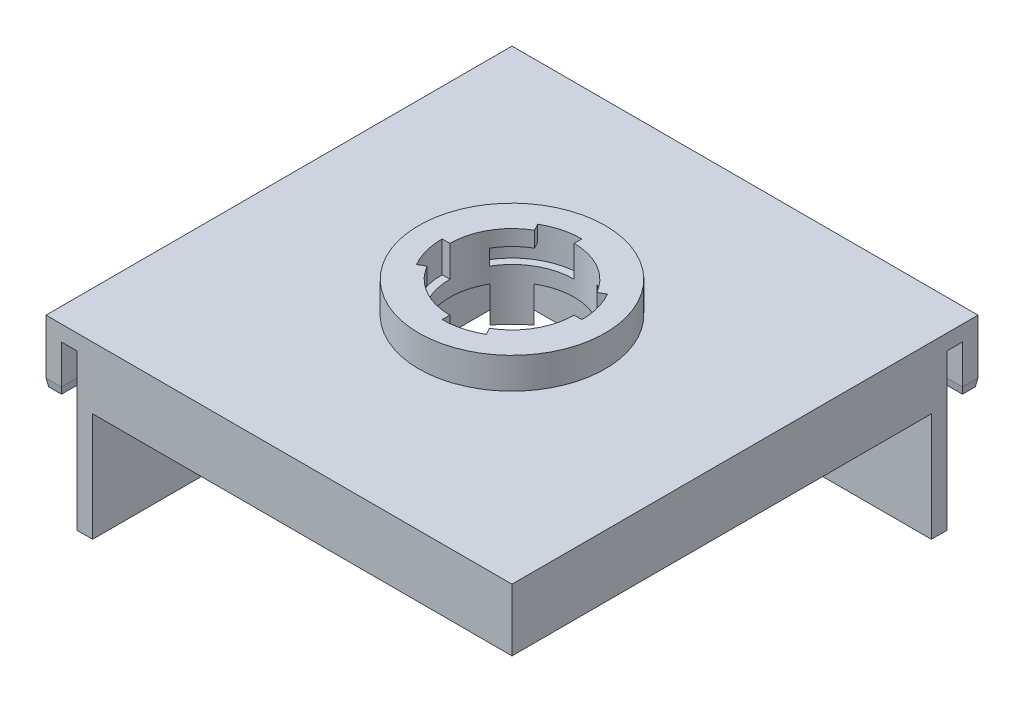
from build123d import *
from OCP.BRepFilletAPI import BRepFilletAPI_MakeChamfer
from build123d.topology import SkipClean

# Parameters (mm, degrees)
SKETCH1_R                 = 12
SKETCH1_R_2               = 8
BOSS_EXTRUDE4_DEPTH       = 2
BOSS_EXTRUDE5_START       = 2
SKETCH1_9_R               = 12
SKETCH1_9_R_2             = 9
BOSS_EXTRUDE5_DEPTH       = 4
BOSS_EXTRUDE6_START       = 2
BOSS_EXTRUDE6_DEPTH       = 2
BOSS_EXTRUDE7_START       = 4
BOSS_EXTRUDE7_DEPTH       = 2
SKETCH1_12_W              = 60
SKETCH1_12_H              = 60
SKETCH1_12_R              = 12
SKETCH1_12_R_2            = 9
SKETCH1_12_R_3            = 8
BOSS_EXTRUDE8_DEPTH       = 2
BOSS_EXTRUDE9_DEPTH       = 6
CHAMFER1_SIZE             = 1
CHAMFER1_SIZE2            = 0.176326981
BOSS_EXTRUDE10_DEPTH      = 6
BOSS_EXTRUDE11_DEPTH      = 20
BOSS_EXTRUDE12_DEPTH      = 2
BOSS_EXTRUDE12_DEPTH_BACK = 2
SKETCH1_14_R              = 8
CUT_EXTRUDE1_DEPTH        = 47.904157598


with BuildPart() as part:
    # Sketch1 → Boss-Extrude4 (new body)
    with BuildSketch(Plane(origin=(0, 0, 0), x_dir=(1, 0, 0), z_dir=(0, 1, 0))):
        with Locations(Location((0, 0, 0), (0, 0, 270))):
            Circle(SKETCH1_R)
        with Locations(Location((0, 0, 0), (0, 0, 270))):
            Circle(SKETCH1_R_2, mode=Mode.SUBTRACT)
    extrude(amount=BOSS_EXTRUDE4_DEPTH)

    # Sketch1<9> → Boss-Extrude5 (add)
    with BuildSketch(Plane(origin=(0, 0, 0), x_dir=(1, 0, 0), z_dir=(0, 1, 0)).offset(BOSS_EXTRUDE5_START)):
        with Locations(Location((0, 0, 0), (0, 0, 270))):
            Circle(SKETCH1_9_R)
        with Locations(Location((0, 0, 0), (0, 0, 270))):
            Circle(SKETCH1_9_R_2, mode=Mode.SUBTRACT)
    extrude(amount=BOSS_EXTRUDE5_DEPTH)

    # Sketch1<10> → Boss-Extrude6 (add)
    with SkipClean():  # the faces are left unmerged after this step: merging them gives an invalid solid
        with BuildSketch(Plane(origin=(0, 0, 0), x_dir=(1, 0, 0), z_dir=(0, 1, 0)).offset(BOSS_EXTRUDE6_START)):
            with BuildLine():
                ThreePointArc((0, 8), (2.070552361, 7.72740661), (4, 6.92820323))
                Line((4, 6.92820323), (4.5, 7.794228634))
                ThreePointArc((4.5, 7.794228634), (2.329371406, 8.693332437), (0, 9))
                Line((0, 9), (0, 8))
            make_face()
            with BuildLine():
                ThreePointArc((-8, 0), (-7.72740661, 2.070552361), (-6.92820323, 4))
                Line((-6.92820323, 4), (-7.794228634, 4.5))
                ThreePointArc((-7.794228634, 4.5), (-8.693332437, 2.329371406), (-9, 0))
                Line((-9, 0), (-8, 0))
            make_face()
            with BuildLine():
                Line((0, -9), (0, -8))
                ThreePointArc((0, -8), (-2.070552361, -7.72740661), (-4, -6.92820323))
                Line((-4, -6.92820323), (-4.5, -7.794228634))
                ThreePointArc((-4.5, -7.794228634), (-2.329371406, -8.693332437), (0, -9))
            make_face()
            with BuildLine():
                Line((9, 0), (8, 0))
                ThreePointArc((8, 0), (7.72740661, -2.070552361), (6.92820323, -4))
                Line((6.92820323, -4), (7.794228634, -4.5))
                ThreePointArc((7.794228634, -4.5), (8.693332437, -2.329371406), (9, 0))
            make_face()
        extrude(amount=BOSS_EXTRUDE6_DEPTH)

    # Sketch1<11> → Boss-Extrude7 (add)
    with SkipClean():  # the faces are left unmerged after this step: merging them gives an invalid solid
        with BuildSketch(Plane(origin=(0, 0, 0), x_dir=(1, 0, 0), z_dir=(0, 1, 0)).offset(BOSS_EXTRUDE7_START)):
            with BuildLine():
                ThreePointArc((0, 8), (2.070552361, 7.72740661), (4, 6.92820323))
                Line((4, 6.92820323), (4.5, 7.794228634))
                ThreePointArc((4.5, 7.794228634), (2.329371406, 8.693332437), (0, 9))
                Line((0, 9), (0, 8))
            make_face()
            with BuildLine():
                ThreePointArc((4, 6.92820323), (5.656854249, 5.656854249), (6.92820323, 4))
                Line((6.92820323, 4), (7.794228634, 4.5))
                ThreePointArc((7.794228634, 4.5), (6.363961031, 6.363961031), (4.5, 7.794228634))
                Line((4.5, 7.794228634), (4, 6.92820323))
            make_face()
            with BuildLine():
                ThreePointArc((-8, 0), (-7.72740661, 2.070552361), (-6.92820323, 4))
                Line((-6.92820323, 4), (-7.794228634, 4.5))
                ThreePointArc((-7.794228634, 4.5), (-8.693332437, 2.329371406), (-9, 0))
                Line((-9, 0), (-8, 0))
            make_face()
            with BuildLine():
                ThreePointArc((-6.92820323, 4), (-5.656854249, 5.656854249), (-4, 6.92820323))
                Line((-4, 6.92820323), (-4.5, 7.794228634))
                ThreePointArc((-4.5, 7.794228634), (-6.363961031, 6.363961031), (-7.794228634, 4.5))
                Line((-7.794228634, 4.5), (-6.92820323, 4))
            make_face()
            with BuildLine():
                Line((-4.5, -7.794228634), (-4, -6.92820323))
                ThreePointArc((-4, -6.92820323), (-5.656854249, -5.656854249), (-6.92820323, -4))
                Line((-6.92820323, -4), (-7.794228634, -4.5))
                ThreePointArc((-7.794228634, -4.5), (-6.363961031, -6.363961031), (-4.5, -7.794228634))
            make_face()
            with BuildLine():
                Line((0, -9), (0, -8))
                ThreePointArc((0, -8), (-2.070552361, -7.72740661), (-4, -6.92820323))
                Line((-4, -6.92820323), (-4.5, -7.794228634))
                ThreePointArc((-4.5, -7.794228634), (-2.329371406, -8.693332437), (0, -9))
            make_face()
            with BuildLine():
                Line((9, 0), (8, 0))
                ThreePointArc((8, 0), (7.72740661, -2.070552361), (6.92820323, -4))
                Line((6.92820323, -4), (7.794228634, -4.5))
                ThreePointArc((7.794228634, -4.5), (8.693332437, -2.329371406), (9, 0))
            make_face()
            with BuildLine():
                Line((7.794228634, -4.5), (6.92820323, -4))
                ThreePointArc((6.92820323, -4), (5.656854249, -5.656854249), (4, -6.92820323))
                Line((4, -6.92820323), (4.5, -7.794228634))
                ThreePointArc((4.5, -7.794228634), (6.363961031, -6.363961031), (7.794228634, -4.5))
            make_face()
        extrude(amount=BOSS_EXTRUDE7_DEPTH)

    # Sketch1<12> → Boss-Extrude8 (add)
    # profile 1 of 2: a face of its own
    with BuildSketch(Plane(origin=(0, 0, 0), x_dir=(1, 0, 0), z_dir=(0, 1, 0))):
        Rectangle(SKETCH1_12_W, SKETCH1_12_H)
        with Locations(Location((0, 0, 0), (0, 0, 270))):
            Circle(SKETCH1_12_R, mode=Mode.SUBTRACT)
    # profile 2 of 2: a face of its own
    with BuildSketch(Plane(origin=(0, 0, 0), x_dir=(1, 0, 0), z_dir=(0, 1, 0))):
        Circle(SKETCH1_12_R_2)
        with Locations(Location((0, 0, 0), (0, 0, 270))):
            Circle(SKETCH1_12_R_3, mode=Mode.SUBTRACT)
    extrude(amount=BOSS_EXTRUDE8_DEPTH)

    # Sketch3 → Boss-Extrude9 (add)
    with BuildSketch(Plane.XZ):
        Polygon((-30, -30), (30, -30), (30, -28), (-28, -28), (-28, 30), (-30, 30), align=None)
        Polygon((30, -26), (30, -24), (-24, -24), (-24, 30), (-26, 30), (-26, -26), align=None)
    extrude(amount=BOSS_EXTRUDE9_DEPTH)

    # Chamfer1: one chamfer whose edges measure the first distance from different faces: ONE call of the kernel's chamfer builder (chamfer() names one face for all edges)
    chamfer1_edges_1 = [part.edges().sort_by_distance(p)[0] for p in [
        (-28, -6, 1),
    ]]
    chamfer1_side_1 = [part.faces().sort_by_distance(p)[0] for p in [
        (-28, -3, 1),
    ]]
    chamfer1_edges_2 = [part.edges().sort_by_distance(p)[0] for p in [
        (1, -6, -28),
    ]]
    chamfer1_side_2 = [part.faces().sort_by_distance(p)[0] for p in [
        (1, -3, -28),
    ]]
    chamfer1_edges_3 = [part.edges().sort_by_distance(p)[0] for p in [
        (-29, -6, 30),
    ]]
    chamfer1_side_3 = [part.faces().sort_by_distance(p)[0] for p in [
        (-4.5, 0.333333333, 30),
    ]]
    chamfer1_edges_4 = [part.edges().sort_by_distance(p)[0] for p in [
        (-30, -6, 0),
    ]]
    chamfer1_side_4 = [part.faces().sort_by_distance(p)[0] for p in [
        (-30, -2, 0),
    ]]
    chamfer1_edges_5 = [part.edges().sort_by_distance(p)[0] for p in [
        (0, -6, -30),
    ]]
    chamfer1_side_5 = [part.faces().sort_by_distance(p)[0] for p in [
        (0, -2, -30),
    ]]
    chamfer1_edges_6 = [part.edges().sort_by_distance(p)[0] for p in [
        (30, -6, -29),
    ]]
    chamfer1_side_6 = [part.faces().sort_by_distance(p)[0] for p in [
        (30, 0.333333333, -4.5),
    ]]
    chamfer1 = BRepFilletAPI_MakeChamfer(part.part.solid().wrapped)
    for e in chamfer1_edges_1:
        chamfer1.Add(CHAMFER1_SIZE, CHAMFER1_SIZE2, e.wrapped, chamfer1_side_1[0].wrapped)  # the first distance lies on this face
    for e in chamfer1_edges_2:
        chamfer1.Add(CHAMFER1_SIZE, CHAMFER1_SIZE2, e.wrapped, chamfer1_side_2[0].wrapped)  # the first distance lies on this face
    for e in chamfer1_edges_3:
        chamfer1.Add(CHAMFER1_SIZE, CHAMFER1_SIZE2, e.wrapped, chamfer1_side_3[0].wrapped)  # the first distance lies on this face
    for e in chamfer1_edges_4:
        chamfer1.Add(CHAMFER1_SIZE, CHAMFER1_SIZE2, e.wrapped, chamfer1_side_4[0].wrapped)  # the first distance lies on this face
    for e in chamfer1_edges_5:
        chamfer1.Add(CHAMFER1_SIZE, CHAMFER1_SIZE2, e.wrapped, chamfer1_side_5[0].wrapped)  # the first distance lies on this face
    for e in chamfer1_edges_6:
        chamfer1.Add(CHAMFER1_SIZE, CHAMFER1_SIZE2, e.wrapped, chamfer1_side_6[0].wrapped)  # the first distance lies on this face
    add(Compound.cast(chamfer1.Shape()), mode=Mode.REPLACE)

    # Sketch6 → Boss-Extrude10 (add)
    with BuildSketch(Plane.XZ):
        Polygon((-24, 30), (-24, 28), (28, 28), (28, -24), (30, -24), (30, 30), align=None)
    extrude(amount=BOSS_EXTRUDE10_DEPTH)

    # Sketch3<3> → Boss-Extrude11 (add)
    with SkipClean():  # the faces are left unmerged after this step: merging them gives an invalid solid
        with BuildSketch(Plane.XZ):
            Polygon((-26, 30), (-26, -26), (-24, -24), (-24, 30), align=None)
            Polygon((-26, -26), (30, -26), (30, -24), (-24, -24), align=None)
        extrude(amount=BOSS_EXTRUDE11_DEPTH)

    # Sketch9 → Boss-Extrude12 (add, two sides: drawn at the far end of the back side and taken through both)
    with SkipClean():  # the faces are left unmerged after this step: merging them gives an invalid solid
        with BuildSketch(Plane(origin=(0, 0, 0), x_dir=(-0.7071067811865472, 0, -0.7071067811865478), z_dir=(0.7071067811865478, 0, -0.7071067811865472)).offset(-BOSS_EXTRUDE12_DEPTH_BACK)):
            Polygon((33.941125497, -20), (33.941125497, 0), (8, 0), (8, -4.714045208), align=None)
            Polygon((8, -4.714045208), (8, 0), (0, 0), align=None)
        extrude(amount=BOSS_EXTRUDE12_DEPTH + BOSS_EXTRUDE12_DEPTH_BACK)

    # Sketch1<14> → Cut-Extrude1 (cut, through all)
    with SkipClean():  # the faces are left unmerged after this step: merging them gives an invalid solid
        with BuildSketch(Plane(origin=(0, 0, 0), x_dir=(1, 0, 0), z_dir=(0, 1, 0))):
            with Locations(Location((0, 0, 0), (0, 0, 90))):
                Circle(SKETCH1_14_R)
        extrude(amount=-CUT_EXTRUDE1_DEPTH, mode=Mode.SUBTRACT)


solid = part.part
